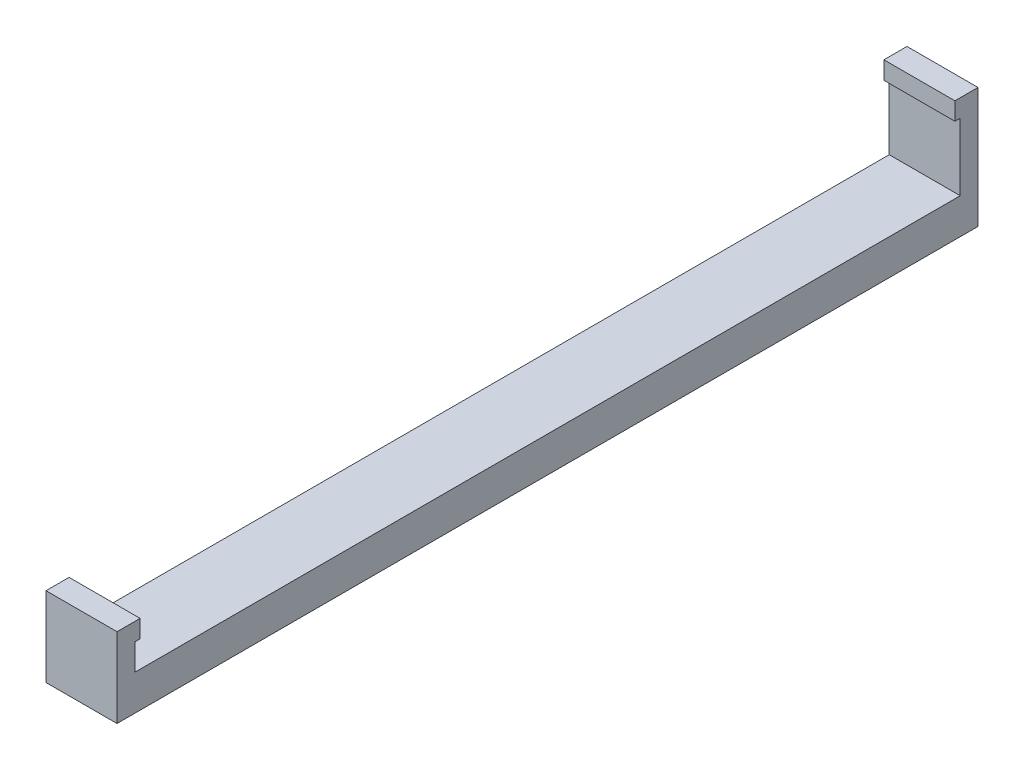
from build123d import *

# Parameters (mm, degrees)
SKETCH1_W           = 10
SKETCH1_H           = 116.22
BOSS_EXTRUDE1_DEPTH = 5
BOSS_EXTRUDE2_DEPTH = 10


with BuildPart() as part:
    # Sketch1 → Boss-Extrude1 (new body)
    with BuildSketch(Plane(origin=(0, 0, 0), x_dir=(1, 0, 0), z_dir=(0, 1, 0))):
        with Locations((5, 58.11)):
            Rectangle(SKETCH1_W, SKETCH1_H)
    extrude(amount=BOSS_EXTRUDE1_DEPTH)

    # Sketch3 → Boss-Extrude2 (add, through all)
    with BuildSketch(Plane(origin=(10, 0, 0), x_dir=(0, 0, -1), z_dir=(1, 0, 0))):
        Polygon((0.75, 8.7), (0, 8.7), (0, 0), (-2.5, 0), (-2.5, 8.7), (-2.5, 11.2), (0.75, 11.2), align=None)
        Polygon((116.22, 0), (118.72, 0), (118.72, 14.45), (118.72, 16.95), (115.47, 16.95), (115.47, 14.45), (116.22, 14.45), align=None)
    extrude(amount=-BOSS_EXTRUDE2_DEPTH)


solid = part.part
